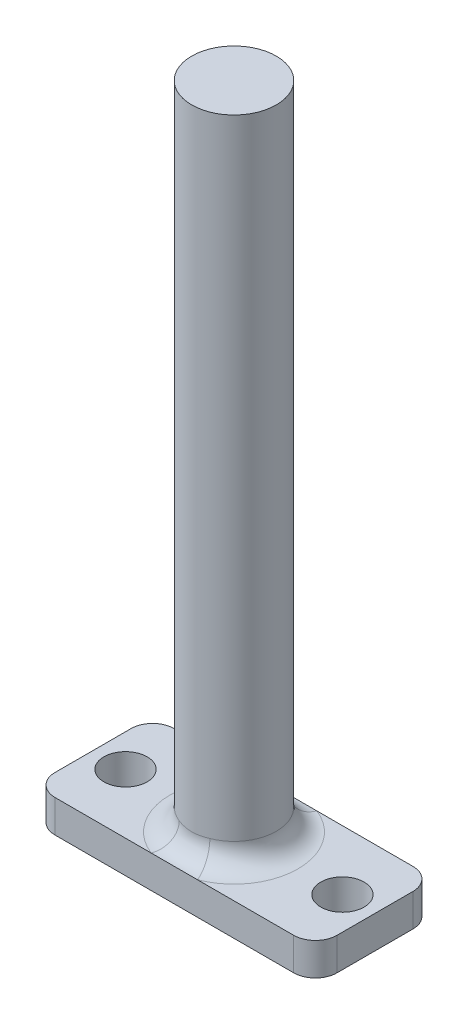
from build123d import *

# Parameters (mm, degrees)
SKETCH1_R           = 2.54
BOSS_EXTRUDE1_DEPTH = 3.81
SKETCH2_R           = 4.953
BOSS_EXTRUDE2_DEPTH = 76.2
FILLET1_R           = 2.54


with BuildPart() as part:
    # Sketch1 → Boss-Extrude1 (new body)
    with BuildSketch(Plane(origin=(0, 0, 0), x_dir=(1, 0, 0), z_dir=(0, 1, 0))):
        with BuildLine():
            Line((-13.97, -6.985), (13.97, -6.985))
            ThreePointArc((13.97, -6.985), (15.766051224, -6.241051224), (16.51, -4.445))
            Line((16.51, -4.445), (16.51, 4.445))
            ThreePointArc((16.51, 4.445), (15.766051224, 6.241051224), (13.97, 6.985))
            Line((13.97, 6.985), (-13.97, 6.985))
            ThreePointArc((-13.97, 6.985), (-15.766051224, 6.241051224), (-16.51, 4.445))
            Line((-16.51, 4.445), (-16.51, -4.445))
            ThreePointArc((-16.51, -4.445), (-15.766051224, -6.241051224), (-13.97, -6.985))
        make_face()
        with Locations(Location((-12.7, 0, 0), (0, 0, 90))):
            Circle(SKETCH1_R, mode=Mode.SUBTRACT)
        with Locations(Location((12.7, 0, 0), (0, 0, 90))):
            Circle(SKETCH1_R, mode=Mode.SUBTRACT)
    extrude(amount=BOSS_EXTRUDE1_DEPTH)

    # Sketch2 → Boss-Extrude2 (add)
    with BuildSketch(Plane(origin=(0, 3.81, 0), x_dir=(1, 0, 0), z_dir=(0, 1, 0))):
        with Locations(Location((0, 0, 0), (0, 0, 90))):
            Circle(SKETCH2_R)
    extrude(amount=BOSS_EXTRUDE2_DEPTH)

    # Fillet1
    fillet1_edges = [part.edges().sort_by_distance(p)[0] for p in [
        (0, 3.81, 4.953),
    ]]
    fillet(fillet1_edges, radius=FILLET1_R)


solid = part.part
